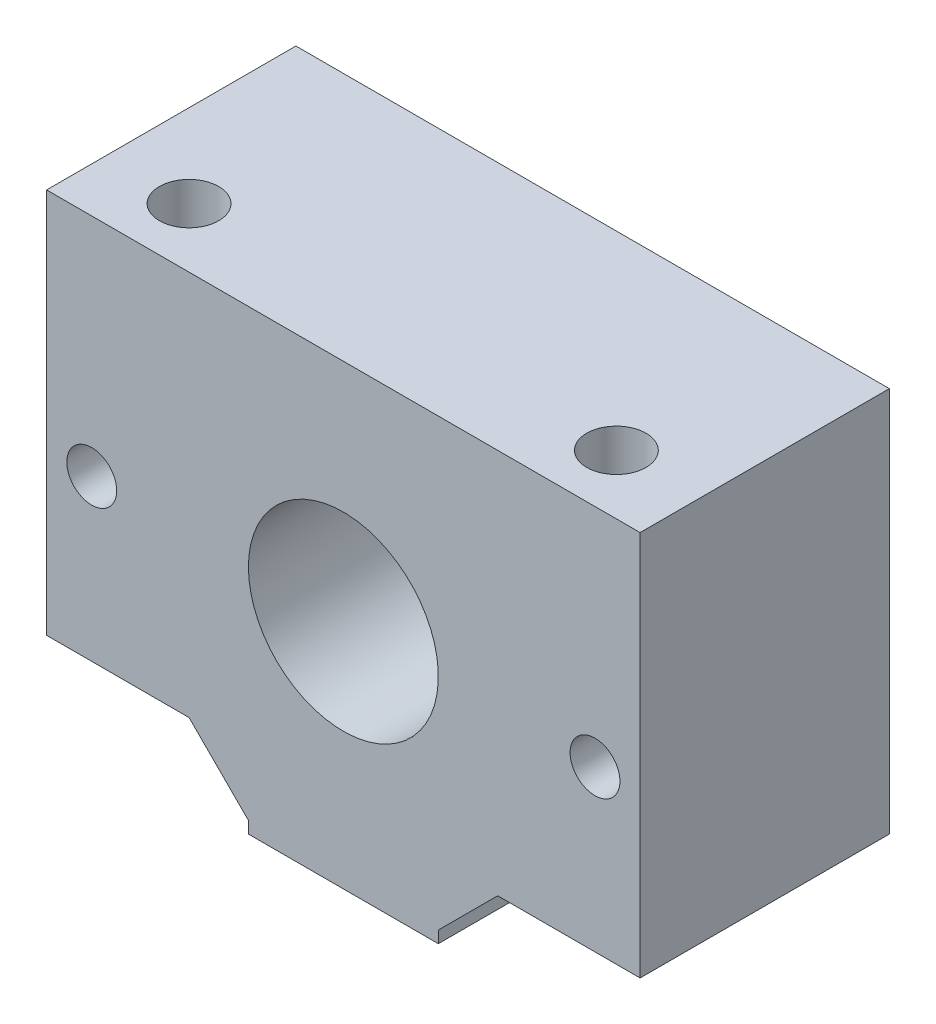
from build123d import *

# Parameters (mm, degrees)
SKETCH_1_R            = 8
EXTRUDE_1_DEPTH       = 21
HOLE_WIZARD_M5_1_D    = 4.2
HOLE_WIZARD_5_0_5_1_D = 5


with BuildPart() as part:
    # 草图1 → 凸台-拉伸1 (new body)
    with BuildSketch(Plane.XY):
        Polygon((8, 0), (-8, 0), (-8, 1), (-13, 6), (-25, 6), (-25, 38.5), (25, 38.5), (25, 6), (13, 6), (8, 1), align=None)
        with Locations(Location((0, 19.5, 0), (0, 0, 180))):
            Circle(SKETCH_1_R, mode=Mode.SUBTRACT)
    extrude(amount=EXTRUDE_1_DEPTH)

    # M5 螺纹孔1 (through all)
    with Locations(Plane.XY.offset(21)):
        with Locations((-21.2, 19.5), (21.2, 19.5)):
            Hole(HOLE_WIZARD_M5_1_D / 2)

    # Ø5.0 (5) 直径孔1 (through all)
    with Locations(Plane(origin=(0, 38.5, 0), x_dir=(1, 0, 0), z_dir=(0, 1, 0))):
        with Locations((-18, -16), (18, -16)):
            Hole(HOLE_WIZARD_5_0_5_1_D / 2)


solid = part.part
